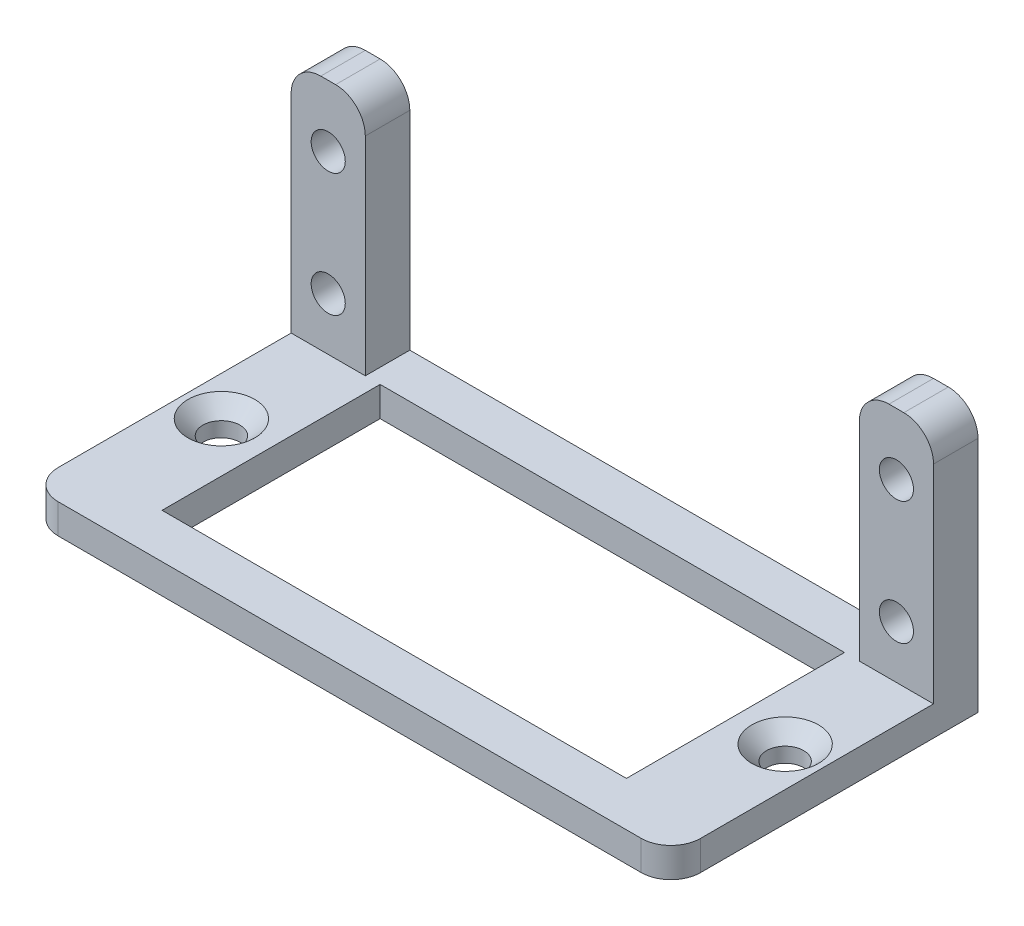
from build123d import *

# Parameters (mm, degrees)
SKETCH1_W               = 54.991
SKETCH1_H               = 26.289
SKETCH1_R               = 1.5875
SKETCH1_W_2             = 39.751
SKETCH1_H_2             = 18.669
BASE_DEPTH              = 2.54
SKETCH2_W               = 54.991
SKETCH2_H               = 3.81
F_4_HOLE_DEPTH          = 20.32
SKETCH3_W               = 42.291
SKETCH3_H               = 20.32
GAP_DEPTH               = 64.65449805
FILLET1_R               = 2.54
CHAMFER1_SIZE           = 1.27
SKETCH4_R               = 1.4605
SERVO_SCREW_HOLES_DEPTH = 64.65449805


with BuildPart() as part:
    # Sketch1 → Base (new body)
    with BuildSketch(Plane(origin=(0, 0, 0), x_dir=(1, 0, 0), z_dir=(0, 1, 0))):
        with Locations((27.4955, 13.1445)):
            Rectangle(SKETCH1_W, SKETCH1_H)
        with Locations(Location((51.6255, 13.1445, 0), (0, 0, 270))):
            Circle(SKETCH1_R, mode=Mode.SUBTRACT)
        with Locations(Location((3.3655, 13.1445, 0), (0, 0, 270))):
            Circle(SKETCH1_R, mode=Mode.SUBTRACT)
        with Locations((27.4955, 13.1445)):
            Rectangle(SKETCH1_W_2, SKETCH1_H_2, mode=Mode.SUBTRACT)
    extrude(amount=BASE_DEPTH)

    # Sketch2 → 4 hole (add)
    with BuildSketch(Plane(origin=(0, 2.54, 0), x_dir=(1, 0, 0), z_dir=(0, 1, 0))):
        with Locations((27.4955, 24.384)):
            Rectangle(SKETCH2_W, SKETCH2_H)
    extrude(amount=F_4_HOLE_DEPTH)

    # Sketch3 → gap (cut, through all)
    with BuildSketch(Plane.XY.offset(-22.479)):
        with Locations((27.4955, 12.7)):
            Rectangle(SKETCH3_W, SKETCH3_H)
    extrude(amount=-GAP_DEPTH, mode=Mode.SUBTRACT)

    # Fillet1
    fillet1_edges = [part.edges().sort_by_distance(p)[0] for p in [
        (0, 22.86, -24.384),
        (54.991, 22.86, -24.384),
        (6.35, 22.86, -24.384),
        (48.641, 22.86, -24.384),
        (54.991, 1.27, 0),
        (0, 1.27, 0),
    ]]
    fillet(fillet1_edges, radius=FILLET1_R)

    # Chamfer1
    chamfer1_edges = [part.edges().sort_by_distance(p)[0] for p in [
        (51.6255, 2.54, -14.732),
        (3.3655, 2.54, -14.732),
    ]]
    chamfer(chamfer1_edges, length=CHAMFER1_SIZE)

    # Sketch4 → servo screw holes (cut, through all)
    with BuildSketch(Plane.XY.offset(-22.479)):
        with Locations((3.175, 17.5895)):
            Circle(SKETCH4_R)
        with Locations((3.175, 7.0485)):
            Circle(SKETCH4_R)
        with Locations((51.816, 17.5895)):
            Circle(SKETCH4_R)
        with Locations((51.816, 7.0485)):
            Circle(SKETCH4_R)
    extrude(amount=-SERVO_SCREW_HOLES_DEPTH, mode=Mode.SUBTRACT)


solid = part.part
